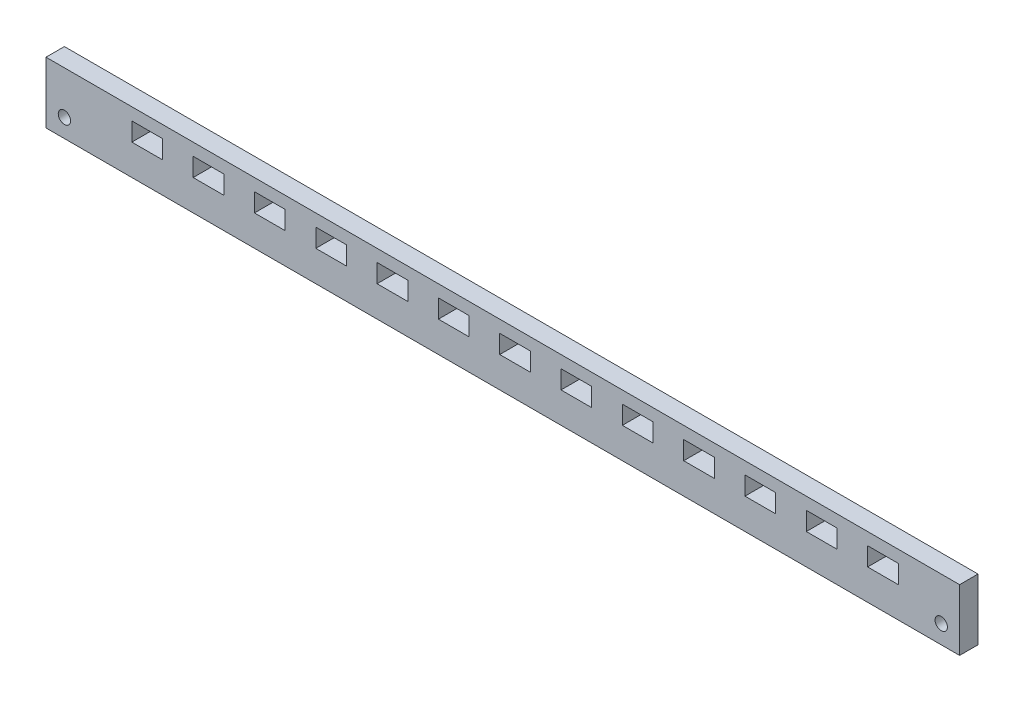
from build123d import *

# Parameters (mm, degrees)
ESQUISSE1_W             = 149
ESQUISSE1_H             = 10
BOSS_EXTRU_1_DEPTH      = 3
ESQUISSE2_R             = 1.005
ESQUISSE2_W             = 5
ESQUISSE2_H             = 3
ENL_V_MAT_EXTRU_1_DEPTH = 150.365323954


with BuildPart() as part:
    # Esquisse1 → Boss.-Extru.1 (new body)
    with BuildSketch(Plane.XY):
        with Locations((74.5, 5)):
            Rectangle(ESQUISSE1_W, ESQUISSE1_H)
    extrude(amount=BOSS_EXTRU_1_DEPTH)

    # Esquisse2 → Enlèv. mat.-Extru.1 (cut, through all)
    with BuildSketch(Plane(origin=(0, 0, 0), x_dir=(-1, 0, 0), z_dir=(0, 0, -1))):
        with Locations((-3, 3)):
            Circle(ESQUISSE2_R)
        with Locations((-146, 3)):
            Circle(ESQUISSE2_R)
        with Locations((-136.5, 6.5)):
            Rectangle(ESQUISSE2_W, ESQUISSE2_H)
        with Locations((-126.5, 6.5)):
            Rectangle(ESQUISSE2_W, ESQUISSE2_H)
        with Locations((-116.5, 6.5)):
            Rectangle(ESQUISSE2_W, ESQUISSE2_H)
        with Locations((-106.5, 6.5)):
            Rectangle(ESQUISSE2_W, ESQUISSE2_H)
        with Locations((-96.5, 6.5)):
            Rectangle(ESQUISSE2_W, ESQUISSE2_H)
        with Locations((-86.5, 6.5)):
            Rectangle(ESQUISSE2_W, ESQUISSE2_H)
        with Locations((-76.5, 6.5)):
            Rectangle(ESQUISSE2_W, ESQUISSE2_H)
        with Locations((-66.5, 6.5)):
            Rectangle(ESQUISSE2_W, ESQUISSE2_H)
        with Locations((-56.5, 6.5)):
            Rectangle(ESQUISSE2_W, ESQUISSE2_H)
        with Locations((-46.5, 6.5)):
            Rectangle(ESQUISSE2_W, ESQUISSE2_H)
        with Locations((-36.5, 6.5)):
            Rectangle(ESQUISSE2_W, ESQUISSE2_H)
        with Locations((-26.5, 6.5)):
            Rectangle(ESQUISSE2_W, ESQUISSE2_H)
        with Locations((-16.5, 6.5)):
            Rectangle(ESQUISSE2_W, ESQUISSE2_H)
    extrude(amount=-ENL_V_MAT_EXTRU_1_DEPTH, mode=Mode.SUBTRACT)


solid = part.part
